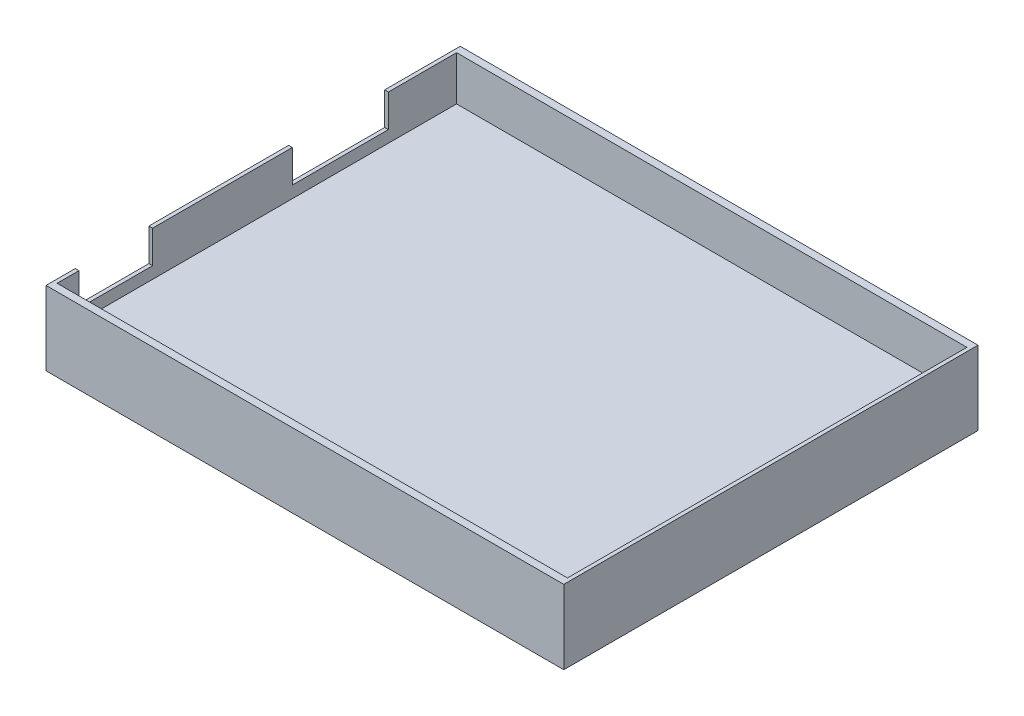
from build123d import *

# Parameters (mm, degrees)
SKETCH1_W           = 70
SKETCH1_H           = 56
BOSS_EXTRUDE1_DEPTH = 10
SKETCH2_W           = 69
SKETCH2_H           = 54
CUT_EXTRUDE1_DEPTH  = 6
SKETCH3_W           = 12.993398332
SKETCH3_H           = 10.754862036
SKETCH3_W_2         = 9.953735061
SKETCH3_H_2         = 10.5
CUT_EXTRUDE2_DEPTH  = 10


with BuildPart() as part:
    # Sketch1 → Boss-Extrude1 (new body)
    with BuildSketch(Plane(origin=(0, 0, 0), x_dir=(1, 0, 0), z_dir=(0, 1, 0))):
        Rectangle(SKETCH1_W, SKETCH1_H)
    extrude(amount=BOSS_EXTRUDE1_DEPTH)

    # Sketch2 → Cut-Extrude1 (cut)
    with BuildSketch(Plane(origin=(0, 10, 0), x_dir=(1, 0, 0), z_dir=(0, 1, 0))):
        Rectangle(SKETCH2_W, SKETCH2_H)
    extrude(amount=-CUT_EXTRUDE1_DEPTH, mode=Mode.SUBTRACT)

    # Sketch3 → Cut-Extrude2 (cut)
    with BuildSketch(Plane.ZY.offset(35)):
        with Locations((-11.292948147, 10.977431018)):
            Rectangle(SKETCH3_W, SKETCH3_H)
        with Locations((19.073286927, 10.85)):
            Rectangle(SKETCH3_W_2, SKETCH3_H_2)
    extrude(amount=-CUT_EXTRUDE2_DEPTH, mode=Mode.SUBTRACT)


solid = part.part
